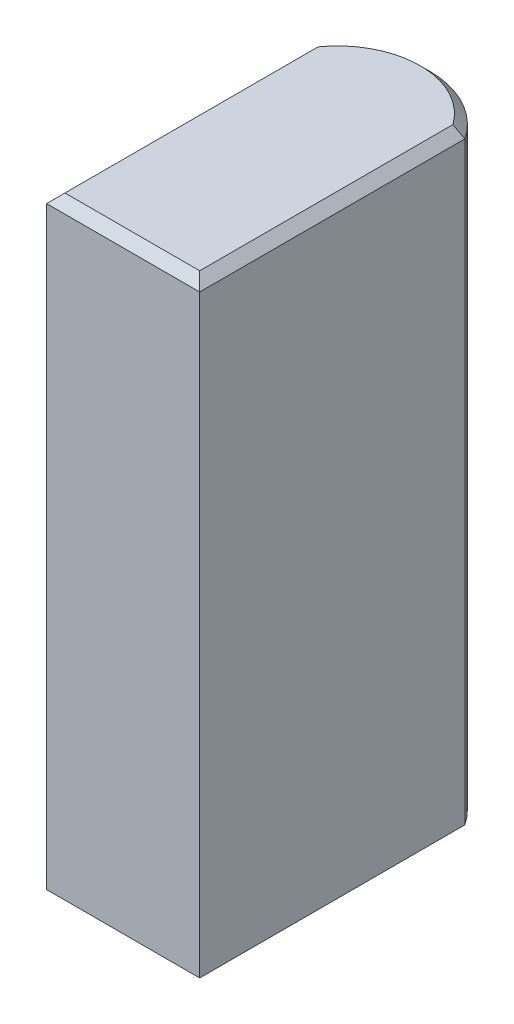
from build123d import *

# Parameters (mm, degrees)
BOSS_EXTRUDE1_DEPTH = 20
CHAMFER1_SIZE       = 0.3


with BuildPart() as part:
    # Sketch1 → Boss-Extrude1 (new body)
    with BuildSketch(Plane(origin=(0, 0, 0), x_dir=(1, 0, 0), z_dir=(0, 1, 0))):
        with BuildLine():
            Line((2.5, 0), (-2.5, 0))
            Line((-2.5, 0), (-2.5, 8.658312395))
            ThreePointArc((-2.5, 8.658312395), (0, 10), (2.5, 8.658312395))
            Line((2.5, 8.658312395), (2.5, 0))
        make_face()
    extrude(amount=BOSS_EXTRUDE1_DEPTH)

    # Chamfer1
    chamfer1_edges = [part.edges().sort_by_distance(p)[0] for p in [
        (0, 20, 0),
        (2.5, 20, -4.329156198),
        (0, 20, -10),
        (2.5, 0, -4.329156198),
        (0, 0, 0),
        (-2.5, 0, -4.329156198),
        (0, 0, -10),
        (-2.5, 20, -4.329156198),
    ]]
    chamfer(chamfer1_edges, length=CHAMFER1_SIZE)


solid = part.part
